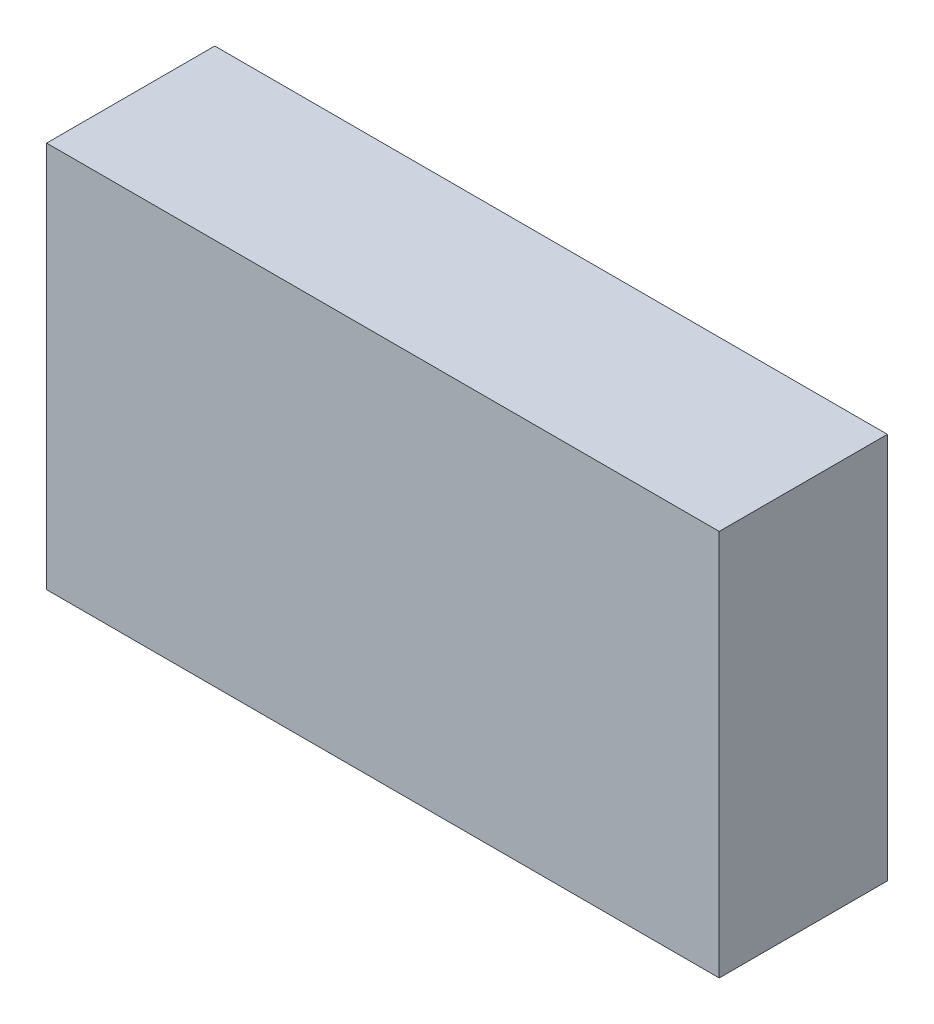
from build123d import *

# Parameters (mm, degrees)
RECTANGLESKETCH_W = 40
RECTANGLESKETCH_H = 23
BLINDBOSS_DEPTH   = 10


with BuildPart() as part:
    # RectangleSketch → BlindBoss (new body)
    with BuildSketch(Plane.XY):
        with Locations((20, 11.5)):
            Rectangle(RECTANGLESKETCH_W, RECTANGLESKETCH_H)
    extrude(amount=BLINDBOSS_DEPTH)


solid = part.part
